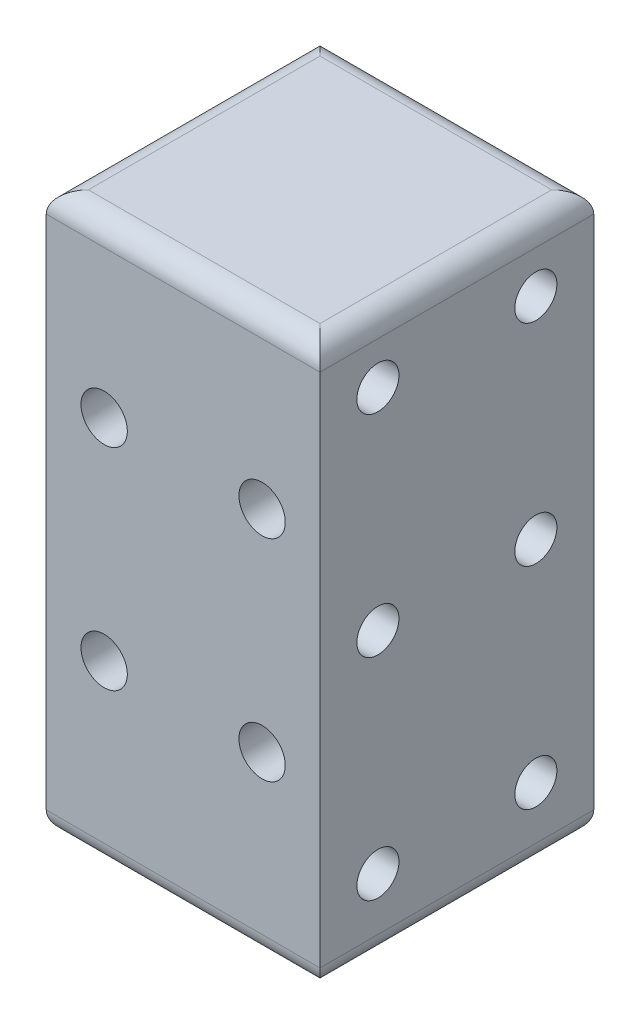
from build123d import *

# Parameters (mm, degrees)
SKETCH_1_W          = 26
SKETCH_1_H          = 26
EXTRUDE_1_DEPTH     = 53
FILLET_2_R          = 2
CUT_EXTRUDE_1_REACH = 62.448
SKETCH_2_R          = 1.55
CUT_EXTRUDE_2_REACH = 62.448
SKETCH_3_R          = 2
CUT_EXTRUDE_3_REACH = 62.448
SKETCH_4_R          = 2.2


with BuildPart() as part:
    # 草图1 → 凸台-拉伸1 (new body)
    with BuildSketch(Plane(origin=(0, 0, 0), x_dir=(1, 0, 0), z_dir=(0, 1, 0))):
        Rectangle(SKETCH_1_W, SKETCH_1_H)
    extrude(amount=EXTRUDE_1_DEPTH)

    # 圆角2
    fillet_2_edges = [part.edges().sort_by_distance(p)[0] for p in [
        (-13, 53, 0),
        (0, 53, 13),
        (13, 53, 0),
        (0, 0, 13),
        (-13, 0, 0),
        (0, 0, -13),
        (13, 0, 0),
        (0, 53, -13),
    ]]
    fillet(fillet_2_edges, radius=FILLET_2_R)

    # 草图2 → 切除-拉伸1 (cut, up to next)
    with BuildSketch(Plane.XY.offset(13), mode=Mode.PRIVATE) as cut_extrude_1_sk1:
        with Locations((-7.5, 37)):
            Circle(SKETCH_2_R)
    cut_extrude_1_tool1 = extrude(cut_extrude_1_sk1.sketch, amount=-CUT_EXTRUDE_1_REACH, mode=Mode.PRIVATE) & part.part
    # 草图2 → 切除-拉伸1 (cut, up to next)
    with BuildSketch(Plane.XY.offset(13), mode=Mode.PRIVATE) as cut_extrude_1_sk2:
        with Locations((7.5, 37)):
            Circle(SKETCH_2_R)
    cut_extrude_1_tool2 = extrude(cut_extrude_1_sk2.sketch, amount=-CUT_EXTRUDE_1_REACH, mode=Mode.PRIVATE) & part.part
    # 草图2 → 切除-拉伸1 (cut, up to next)
    with BuildSketch(Plane.XY.offset(13), mode=Mode.PRIVATE) as cut_extrude_1_sk3:
        with Locations((-7.5, 17)):
            Circle(SKETCH_2_R)
    cut_extrude_1_tool3 = extrude(cut_extrude_1_sk3.sketch, amount=-CUT_EXTRUDE_1_REACH, mode=Mode.PRIVATE) & part.part
    # 草图2 → 切除-拉伸1 (cut, up to next)
    with BuildSketch(Plane.XY.offset(13), mode=Mode.PRIVATE) as cut_extrude_1_sk4:
        with Locations((7.5, 17)):
            Circle(SKETCH_2_R)
    cut_extrude_1_tool4 = extrude(cut_extrude_1_sk4.sketch, amount=-CUT_EXTRUDE_1_REACH, mode=Mode.PRIVATE) & part.part
    add(cut_extrude_1_tool1.solids().sort_by_distance((-7.5, 37, 13))[0], mode=Mode.SUBTRACT)
    add(cut_extrude_1_tool2.solids().sort_by_distance((7.5, 37, 13))[0], mode=Mode.SUBTRACT)
    add(cut_extrude_1_tool3.solids().sort_by_distance((-7.5, 17, 13))[0], mode=Mode.SUBTRACT)
    add(cut_extrude_1_tool4.solids().sort_by_distance((7.5, 17, 13))[0], mode=Mode.SUBTRACT)

    # 草图3 → 切除-拉伸2 (cut, up to next)
    with BuildSketch(Plane.ZY.offset(13), mode=Mode.PRIVATE) as cut_extrude_2_sk1:
        with Locations((-7.5, 47)):
            Circle(SKETCH_3_R)
    cut_extrude_2_tool1 = extrude(cut_extrude_2_sk1.sketch, amount=-CUT_EXTRUDE_2_REACH, mode=Mode.PRIVATE) & part.part
    # 草图3 → 切除-拉伸2 (cut, up to next)
    with BuildSketch(Plane.ZY.offset(13), mode=Mode.PRIVATE) as cut_extrude_2_sk2:
        with Locations((7.5, 47)):
            Circle(SKETCH_3_R)
    cut_extrude_2_tool2 = extrude(cut_extrude_2_sk2.sketch, amount=-CUT_EXTRUDE_2_REACH, mode=Mode.PRIVATE) & part.part
    # 草图3 → 切除-拉伸2 (cut, up to next)
    with BuildSketch(Plane.ZY.offset(13), mode=Mode.PRIVATE) as cut_extrude_2_sk3:
        with Locations((-7.5, 27)):
            Circle(SKETCH_3_R)
    cut_extrude_2_tool3 = extrude(cut_extrude_2_sk3.sketch, amount=-CUT_EXTRUDE_2_REACH, mode=Mode.PRIVATE) & part.part
    # 草图3 → 切除-拉伸2 (cut, up to next)
    with BuildSketch(Plane.ZY.offset(13), mode=Mode.PRIVATE) as cut_extrude_2_sk4:
        with Locations((7.5, 27)):
            Circle(SKETCH_3_R)
    cut_extrude_2_tool4 = extrude(cut_extrude_2_sk4.sketch, amount=-CUT_EXTRUDE_2_REACH, mode=Mode.PRIVATE) & part.part
    # 草图3 → 切除-拉伸2 (cut, up to next)
    with BuildSketch(Plane.ZY.offset(13), mode=Mode.PRIVATE) as cut_extrude_2_sk5:
        with Locations((-7.5, 7)):
            Circle(SKETCH_3_R)
    cut_extrude_2_tool5 = extrude(cut_extrude_2_sk5.sketch, amount=-CUT_EXTRUDE_2_REACH, mode=Mode.PRIVATE) & part.part
    # 草图3 → 切除-拉伸2 (cut, up to next)
    with BuildSketch(Plane.ZY.offset(13), mode=Mode.PRIVATE) as cut_extrude_2_sk6:
        with Locations((7.5, 7)):
            Circle(SKETCH_3_R)
    cut_extrude_2_tool6 = extrude(cut_extrude_2_sk6.sketch, amount=-CUT_EXTRUDE_2_REACH, mode=Mode.PRIVATE) & part.part
    add(cut_extrude_2_tool1.solids().sort_by_distance((-13, 47, -7.5))[0], mode=Mode.SUBTRACT)
    add(cut_extrude_2_tool2.solids().sort_by_distance((-13, 47, 7.5))[0], mode=Mode.SUBTRACT)
    add(cut_extrude_2_tool3.solids().sort_by_distance((-13, 27, -7.5))[0], mode=Mode.SUBTRACT)
    add(cut_extrude_2_tool4.solids().sort_by_distance((-13, 27, 7.5))[0], mode=Mode.SUBTRACT)
    add(cut_extrude_2_tool5.solids().sort_by_distance((-13, 7, -7.5))[0], mode=Mode.SUBTRACT)
    add(cut_extrude_2_tool6.solids().sort_by_distance((-13, 7, 7.5))[0], mode=Mode.SUBTRACT)

    # 草图4 → 切除-拉伸3 (cut, up to next)
    with BuildSketch(Plane(origin=(0, 0, -13), x_dir=(-1, 0, 0), z_dir=(0, 0, -1)), mode=Mode.PRIVATE) as cut_extrude_3_sk1:
        with Locations((-7.5, 37)):
            Circle(SKETCH_4_R)
    cut_extrude_3_tool1 = extrude(cut_extrude_3_sk1.sketch, amount=-CUT_EXTRUDE_3_REACH, mode=Mode.PRIVATE) & part.part
    # 草图4 → 切除-拉伸3 (cut, up to next)
    with BuildSketch(Plane(origin=(0, 0, -13), x_dir=(-1, 0, 0), z_dir=(0, 0, -1)), mode=Mode.PRIVATE) as cut_extrude_3_sk2:
        with Locations((7.5, 37)):
            Circle(SKETCH_4_R)
    cut_extrude_3_tool2 = extrude(cut_extrude_3_sk2.sketch, amount=-CUT_EXTRUDE_3_REACH, mode=Mode.PRIVATE) & part.part
    # 草图4 → 切除-拉伸3 (cut, up to next)
    with BuildSketch(Plane(origin=(0, 0, -13), x_dir=(-1, 0, 0), z_dir=(0, 0, -1)), mode=Mode.PRIVATE) as cut_extrude_3_sk3:
        with Locations((7.5, 17)):
            Circle(SKETCH_4_R)
    cut_extrude_3_tool3 = extrude(cut_extrude_3_sk3.sketch, amount=-CUT_EXTRUDE_3_REACH, mode=Mode.PRIVATE) & part.part
    # 草图4 → 切除-拉伸3 (cut, up to next)
    with BuildSketch(Plane(origin=(0, 0, -13), x_dir=(-1, 0, 0), z_dir=(0, 0, -1)), mode=Mode.PRIVATE) as cut_extrude_3_sk4:
        with Locations((-7.5, 17)):
            Circle(SKETCH_4_R)
    cut_extrude_3_tool4 = extrude(cut_extrude_3_sk4.sketch, amount=-CUT_EXTRUDE_3_REACH, mode=Mode.PRIVATE) & part.part
    add(cut_extrude_3_tool1.solids().sort_by_distance((7.5, 37, -13))[0], mode=Mode.SUBTRACT)
    add(cut_extrude_3_tool2.solids().sort_by_distance((-7.5, 37, -13))[0], mode=Mode.SUBTRACT)
    add(cut_extrude_3_tool3.solids().sort_by_distance((-7.5, 17, -13))[0], mode=Mode.SUBTRACT)
    add(cut_extrude_3_tool4.solids().sort_by_distance((7.5, 17, -13))[0], mode=Mode.SUBTRACT)


solid = part.part
